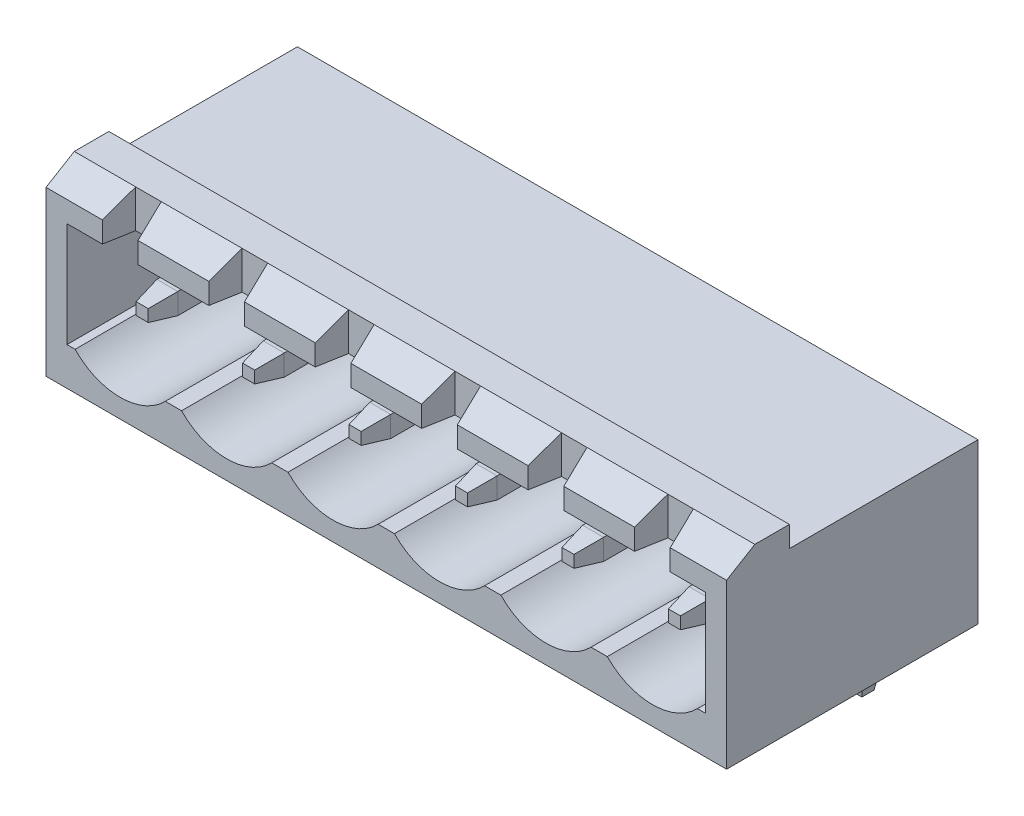
from build123d import *

# Parameters (mm, degrees)
SKETCH1_W           = 32.48
SKETCH1_H           = 7.62
BOSS_EXTRUDE1_DEPTH = 6
BOSS_EXTRUDE6_DEPTH = 32.48
CUT_EXTRUDE1_DEPTH  = 11.2
BOSS_EXTRUDE2_START = 2.5
BOSS_EXTRUDE2_DEPTH = 2.5
SKETCH4_R           = 1
BOSS_EXTRUDE3_DEPTH = 0.7
SKETCH5_W           = 1
SKETCH5_H           = 1
BOSS_EXTRUDE4_DEPTH = 5.75
SKETCH6_W           = 1
SKETCH6_H           = 1
BOSS_EXTRUDE5_DEPTH = 1.2
BOSS_EXTRUDE5_TAPER = 10
CUT_EXTRUDE2_START  = -1.81
CUT_EXTRUDE2_DEPTH  = 1.81
SKETCH10_W          = 1
SKETCH10_H          = 1
BOSS_EXTRUDE7_DEPTH = 2.3
SKETCH11_W          = 1
SKETCH11_H          = 1
BOSS_EXTRUDE8_DEPTH = 1.2
BOSS_EXTRUDE8_TAPER = 10
SKETCH12_W          = 2
SKETCH12_H          = 6.75
CUT_EXTRUDE3_DEPTH  = 0.5
LPATTERN1_COUNT     = 6
LPATTERN1_PITCH     = 5.08
LPATTERN2_COUNT     = 6
LPATTERN2_PITCH     = 5.08


with BuildPart() as part:
    # Sketch1 → Boss-Extrude1 (new, symmetric)
    with BuildSketch(Plane.XY):
        Rectangle(SKETCH1_W, SKETCH1_H)
    extrude(amount=BOSS_EXTRUDE1_DEPTH, both=True)

    # Sketch7 → Boss-Extrude6 (add)
    with BuildSketch(Plane(origin=(16.24, 0, 0), x_dir=(0, 0, -1), z_dir=(1, 0, 0))):
        Polygon((-6, 3.81), (-6, 4), (-4.65, 4.81), (-3, 4.81), (-3, 3.81), align=None)
    extrude(amount=-BOSS_EXTRUDE6_DEPTH)

    # Sketch2 → Cut-Extrude1 (cut)
    with BuildSketch(Plane.XY.offset(6)):
        with BuildLine():
            Line((10.547815064, -2), (10.16, -2))
            Line((10.16, -2), (10.16, 3))
            Line((10.16, 3), (15.24, 3))
            Line((15.24, 3), (15.24, -2))
            Line((15.24, -2), (14.852184936, -2))
            ThreePointArc((14.852184936, -2), (12.7, -2.91), (10.547815064, -2))
        make_face()
    cut_extrude1 = extrude(amount=-CUT_EXTRUDE1_DEPTH, mode=Mode.SUBTRACT)

    # Sketch3 → Boss-Extrude2 (add)
    with BuildSketch(Plane.XY.offset(-5.2).offset(BOSS_EXTRUDE2_START)):
        with BuildLine():
            Line((11.7, -1.028033989), (11.7, -2.738427125))
            ThreePointArc((11.7, -2.738427125), (12.7, -2.91), (13.7, -2.738427125))
            Line((13.7, -2.738427125), (13.7, -1.028033989))
            ThreePointArc((13.7, -1.028033989), (14.013299556, -0.634737384), (14.179019946, -0.16))
            Line((14.179019946, -0.16), (15.24, -0.16))
            Line((15.24, -0.16), (15.24, 0.34))
            Line((15.24, 0.34), (14.179019946, 0.34))
            ThreePointArc((14.179019946, 0.34), (13.760660172, 1.150660172), (12.95, 1.569019946))
            Line((12.95, 1.569019946), (12.95, 3))
            Line((12.95, 3), (12.45, 3))
            Line((12.45, 3), (12.45, 1.569019946))
            ThreePointArc((12.45, 1.569019946), (11.639339828, 1.150660172), (11.220980054, 0.34))
            Line((11.220980054, 0.34), (10.16, 0.34))
            Line((10.16, 0.34), (10.16, -0.16))
            Line((10.16, -0.16), (11.220980054, -0.16))
            ThreePointArc((11.220980054, -0.16), (11.386700444, -0.634737384), (11.7, -1.028033989))
        make_face()
    boss_extrude2 = extrude(amount=-BOSS_EXTRUDE2_DEPTH)

    # Sketch4 → Boss-Extrude3 (add)
    with BuildSketch(Plane.XY.offset(-2.7)):
        with Locations((12.7, 0.09)):
            Circle(SKETCH4_R)
    boss_extrude3 = extrude(amount=BOSS_EXTRUDE3_DEPTH)

    # Sketch9 → Cut-Extrude2 (cut)
    with BuildSketch(Plane(origin=(0, 4.81, 0), x_dir=(1, 0, 0), z_dir=(0, 1, 0)).offset(CUT_EXTRUDE2_START)):
        Polygon((11.85, -6), (12.09, -4.65), (13.31, -4.65), (13.55, -6), align=None)
    cut_extrude2 = extrude(amount=CUT_EXTRUDE2_DEPTH, mode=Mode.SUBTRACT)

    # Sketch12 → Cut-Extrude3 (cut)
    with BuildSketch(Plane(origin=(0, 0, -6), x_dir=(-1, 0, 0), z_dir=(0, 0, -1))):
        with Locations((-12.7, -0.435)):
            Rectangle(SKETCH12_W, SKETCH12_H)
    cut_extrude3 = extrude(amount=-CUT_EXTRUDE3_DEPTH, mode=Mode.SUBTRACT)

    # LPattern1: Cut-Extrude1, Boss-Extrude2, Boss-Extrude3, Cut-Extrude2, Cut-Extrude3 ×6
    with Locations(*[(-i * LPATTERN1_PITCH, 0, 0) for i in range(1, LPATTERN1_COUNT)]):
        add(cut_extrude1, mode=Mode.SUBTRACT)
        add(boss_extrude2)
        add(boss_extrude3)
        add(cut_extrude2, mode=Mode.SUBTRACT)
        add(cut_extrude3, mode=Mode.SUBTRACT)


with BuildPart() as body_2:
    # Sketch5 → Boss-Extrude4 (new body)
    with BuildSketch(Plane.XY.offset(-2)):
        with Locations((12.7, 0.09)):
            Rectangle(SKETCH5_W, SKETCH5_H)
    extrude(amount=BOSS_EXTRUDE4_DEPTH)

    # Sketch6 → Boss-Extrude5 (add)
    with BuildSketch(Plane.XY.offset(3.75)):
        with Locations((12.7, 0.09)):
            Rectangle(SKETCH6_W, SKETCH6_H)
    extrude(amount=BOSS_EXTRUDE5_DEPTH, taper=BOSS_EXTRUDE5_TAPER)


with BuildPart() as body_3:
    # Sketch10 → Boss-Extrude7 (new body)
    with BuildSketch(Plane.XZ.offset(3.81)):
        with Locations((12.7, -4)):
            Rectangle(SKETCH10_W, SKETCH10_H)
    extrude(amount=BOSS_EXTRUDE7_DEPTH)

    # Sketch11 → Boss-Extrude8 (add)
    with BuildSketch(Plane.XZ.offset(6.11)):
        with Locations((12.7, -4)):
            Rectangle(SKETCH11_W, SKETCH11_H)
    extrude(amount=BOSS_EXTRUDE8_DEPTH, taper=BOSS_EXTRUDE8_TAPER)


with BuildPart() as lpattern2_1:
    # LPattern2: pattern copy
    add(body_3.part.moved(Location(Vector(-1, 0, 0) * (1 * LPATTERN2_PITCH))))


with BuildPart() as lpattern2_2:
    # LPattern2: pattern copy
    add(body_3.part.moved(Location(Vector(-1, 0, 0) * (2 * LPATTERN2_PITCH))))


with BuildPart() as lpattern2_3:
    # LPattern2: pattern copy
    add(body_3.part.moved(Location(Vector(-1, 0, 0) * (3 * LPATTERN2_PITCH))))


with BuildPart() as lpattern2_4:
    # LPattern2: pattern copy
    add(body_3.part.moved(Location(Vector(-1, 0, 0) * (4 * LPATTERN2_PITCH))))


with BuildPart() as lpattern2_5:
    # LPattern2: pattern copy
    add(body_3.part.moved(Location(Vector(-1, 0, 0) * (5 * LPATTERN2_PITCH))))


with BuildPart() as lpattern2_6:
    # LPattern2: pattern copy
    add(body_2.part.moved(Location(Vector(-1, 0, 0) * (1 * LPATTERN2_PITCH))))


with BuildPart() as lpattern2_7:
    # LPattern2: pattern copy
    add(body_2.part.moved(Location(Vector(-1, 0, 0) * (2 * LPATTERN2_PITCH))))


with BuildPart() as lpattern2_8:
    # LPattern2: pattern copy
    add(body_2.part.moved(Location(Vector(-1, 0, 0) * (3 * LPATTERN2_PITCH))))


with BuildPart() as lpattern2_9:
    # LPattern2: pattern copy
    add(body_2.part.moved(Location(Vector(-1, 0, 0) * (4 * LPATTERN2_PITCH))))


with BuildPart() as lpattern2_10:
    # LPattern2: pattern copy
    add(body_2.part.moved(Location(Vector(-1, 0, 0) * (5 * LPATTERN2_PITCH))))


solid = Compound([part.part, body_2.part, body_3.part, lpattern2_1.part, lpattern2_2.part, lpattern2_3.part, lpattern2_4.part, lpattern2_5.part, lpattern2_6.part, lpattern2_7.part, lpattern2_8.part, lpattern2_9.part, lpattern2_10.part])
